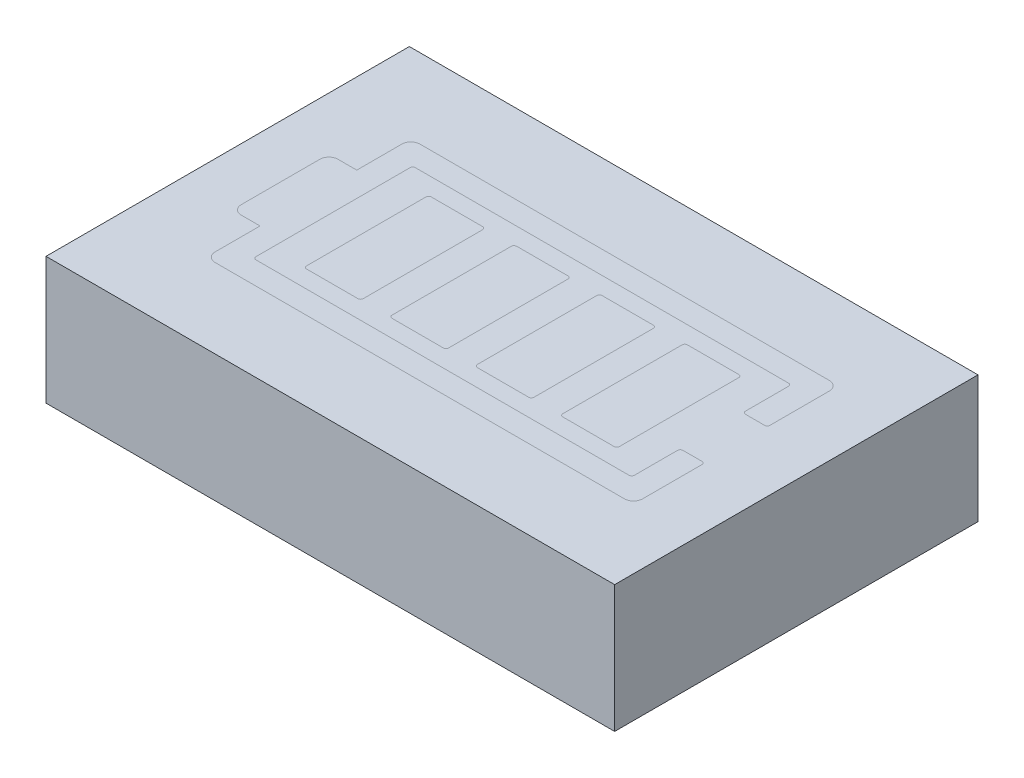
from build123d import *

# Parameters (mm, degrees)
SKETCH1_W           = 31.3
SKETCH1_H           = 20
BOSS_EXTRUDE1_DEPTH = 7
SKETCH2_W           = 31.3
SKETCH2_H           = 20
BOSS_EXTRUDE2_DEPTH = 1
BOSS_EXTRUDE4_START = -0.25
SKETCH3_W           = 29.3
SKETCH3_H           = 18
BOSS_EXTRUDE4_DEPTH = 5.75


with BuildPart() as part:
    # Sketch1 → Boss-Extrude1 (new body)
    with BuildSketch(Plane(origin=(0, 0, 0), x_dir=(1, 0, 0), z_dir=(0, 1, 0))):
        Rectangle(SKETCH1_W, SKETCH1_H)
        Polygon((-14.65, -9), (-14.65, 9), (-7, 9), (-7, 7), (-6, 7), (-6, 9), (6, 9), (6, 7), (7, 7), (7, 9), (14.65, 9), (14.65, -9), (7, -9), (7, -7), (6, -7), (6, -9), (-6, -9), (-6, -7), (-7, -7), (-7, -9), align=None, mode=Mode.SUBTRACT)
    extrude(amount=BOSS_EXTRUDE1_DEPTH)

    # Sketch2 → Boss-Extrude2 (add)
    with BuildSketch(Plane(origin=(0, 7, 0), x_dir=(1, 0, 0), z_dir=(0, 1, 0))):
        Rectangle(SKETCH2_W, SKETCH2_H)
    extrude(amount=-BOSS_EXTRUDE2_DEPTH)

    # Sketch3 → Boss-Extrude4 (add)
    with BuildSketch(Plane.XZ.offset(BOSS_EXTRUDE4_START)):
        Rectangle(SKETCH3_W, SKETCH3_H)
    extrude(amount=-BOSS_EXTRUDE4_DEPTH)


solid = part.part
